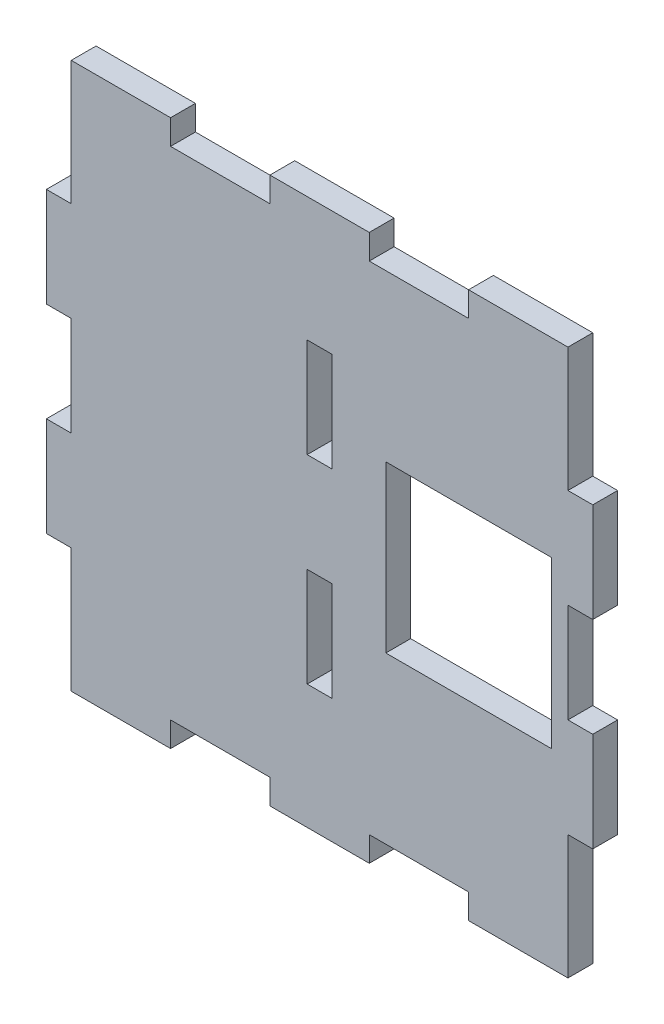
from build123d import *

# Parameters (mm, degrees)
ESBO_O1_W                = 3
ESBO_O1_H                = 12
ESBO_O1_W_2              = 20
ESBO_O1_H_2              = 20
RESSALTO_EXTRUS_O1_DEPTH = 3


with BuildPart() as part:
    # Esboço1 → Ressalto-extrusão1 (new body)
    with BuildSketch(Plane.XY):
        Polygon((-31.216896784, 10.517052385), (-31.216896784, -1.482947615), (-34.216896784, -1.482947615), (-34.216896784, -13.482947615), (-31.216896784, -13.482947615), (-31.216896784, -25.482947615), (-31.216896784, -28.482947615), (-19.216896784, -28.482947615), (-19.216896784, -25.482947615), (-7.216896784, -25.482947615), (-7.216896784, -28.482947615), (4.783103216, -28.482947615), (4.783103216, -25.482947615), (16.783103216, -25.482947615), (16.783103216, -28.482947615), (28.783103216, -28.482947615), (28.783103216, -25.482947615), (28.783103216, -13.482947615), (31.783103216, -13.482947615), (31.783103216, -1.482947615), (28.783103216, -1.482947615), (28.783103216, 10.517052385), (31.783103216, 10.517052385), (31.783103216, 22.517052385), (28.783103216, 22.517052385), (28.783103216, 34.517052385), (28.783103216, 37.517052385), (16.783103216, 37.517052385), (16.783103216, 34.517052385), (4.783103216, 34.517052385), (4.783103216, 37.517052385), (-7.216896784, 37.517052385), (-7.216896784, 34.517052385), (-19.216896784, 34.517052385), (-19.216896784, 37.517052385), (-31.216896784, 37.517052385), (-31.216896784, 34.517052385), (-31.216896784, 22.517052385), (-34.216896784, 22.517052385), (-34.216896784, 10.517052385), align=None)
        with Locations((-1.216896784, 16.517052385)):
            Rectangle(ESBO_O1_W, ESBO_O1_H, mode=Mode.SUBTRACT)
        with Locations((-1.216896784, -7.482947615)):
            Rectangle(ESBO_O1_W, ESBO_O1_H, mode=Mode.SUBTRACT)
        with Locations((16.783103216, 4.517052385)):
            Rectangle(ESBO_O1_W_2, ESBO_O1_H_2, mode=Mode.SUBTRACT)
    extrude(amount=RESSALTO_EXTRUS_O1_DEPTH)


solid = part.part
